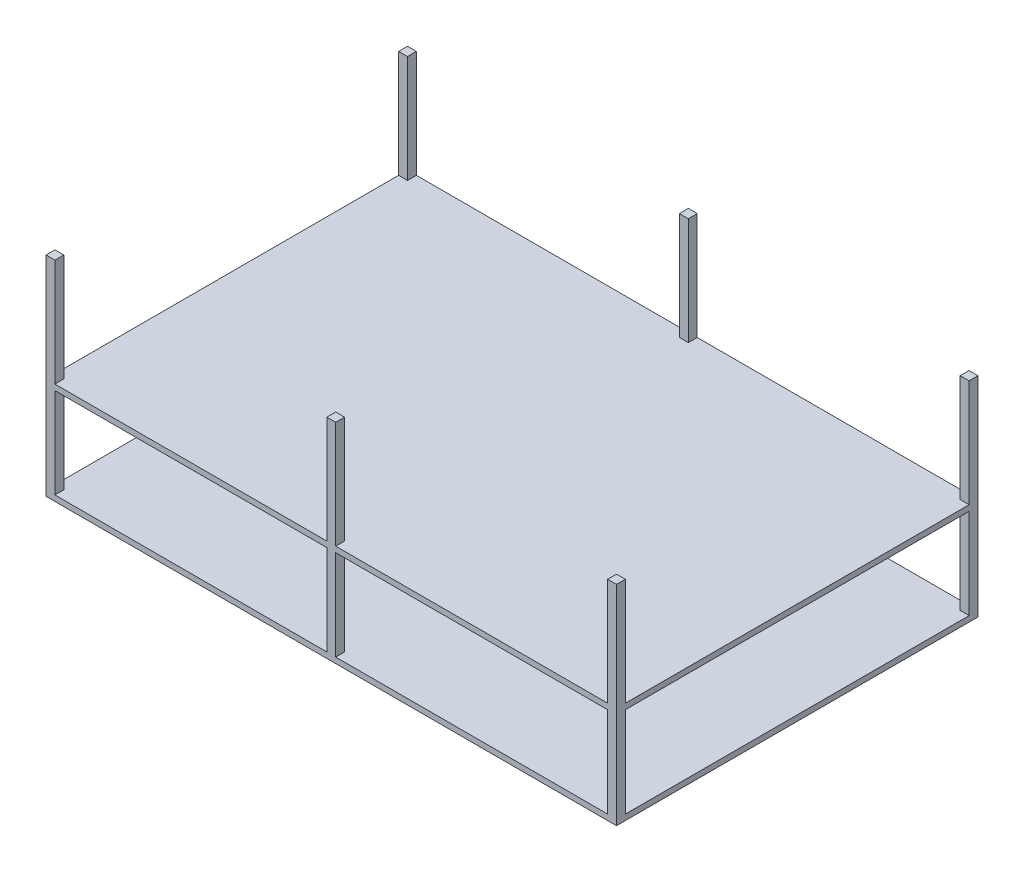
from build123d import *

# Parameters (mm, degrees)
SKETCH1_W             = 40
SKETCH1_H             = 40
BOSS_EXTRUDE1_DEPTH   = 939.8
BOSS_EXTRUDE1_2_DEPTH = 939.8
BOSS_EXTRUDE1_3_DEPTH = 939.8
BOSS_EXTRUDE1_4_DEPTH = 939.8
BOSS_EXTRUDE1_5_DEPTH = 939.8
BOSS_EXTRUDE1_6_DEPTH = 939.8
SKETCH2_W             = 2565.4
SKETCH2_H             = 1625.6
BOSS_EXTRUDE2_DEPTH   = 25.4
SKETCH3_W             = 2565.4
SKETCH3_H             = 1625.6
BOSS_EXTRUDE3_DEPTH   = 25.4


with BuildPart() as part:
    # Sketch1 → Boss-Extrude1 (new body)
    with BuildSketch(Plane.XZ.offset(-2661.458218508)):
        with Locations((1253.466421536, 801.437438082)):
            Rectangle(SKETCH1_W, SKETCH1_H)
    extrude(amount=BOSS_EXTRUDE1_DEPTH)



with BuildPart() as body_2:
    # Sketch1 → Boss-Extrude1 2 (new body)
    with BuildSketch(Plane.XZ.offset(-2661.458218508)):
        with Locations((-1271.933578464, 801.437438082)):
            Rectangle(SKETCH1_W, SKETCH1_H)
    extrude(amount=BOSS_EXTRUDE1_2_DEPTH)


with BuildPart() as body_3:
    # Sketch1 → Boss-Extrude1 3 (new body)
    with BuildSketch(Plane.XZ.offset(-2661.458218508)):
        with Locations((-9.233578464, 801.437438082)):
            Rectangle(SKETCH1_W, SKETCH1_H)
    extrude(amount=BOSS_EXTRUDE1_3_DEPTH)


with BuildPart() as body_4:
    # Sketch1 → Boss-Extrude1 4 (new body)
    with BuildSketch(Plane.XZ.offset(-2661.458218508)):
        with Locations((-1271.933578464, -784.162561918)):
            Rectangle(SKETCH1_W, SKETCH1_H)
    extrude(amount=BOSS_EXTRUDE1_4_DEPTH)


with BuildPart() as body_5:
    # Sketch1 → Boss-Extrude1 5 (new body)
    with BuildSketch(Plane.XZ.offset(-2661.458218508)):
        with Locations((-9.233578464, -784.162561918)):
            Rectangle(SKETCH1_W, SKETCH1_H)
    extrude(amount=BOSS_EXTRUDE1_5_DEPTH)


with BuildPart() as body_6:
    # Sketch1 → Boss-Extrude1 6 (new body)
    with BuildSketch(Plane.XZ.offset(-2661.458218508)):
        with Locations((1253.466421536, -784.162561918)):
            Rectangle(SKETCH1_W, SKETCH1_H)
    extrude(amount=BOSS_EXTRUDE1_6_DEPTH)


with BuildPart() as part_1:
    add(part.part)

    add(body_2.part)  # Boss-Extrude2 merges body 2

    add(body_3.part)  # Boss-Extrude2 merges body 3

    add(body_4.part)  # Boss-Extrude2 merges body 4

    add(body_5.part)  # Boss-Extrude2 merges body 5

    add(body_6.part)  # Boss-Extrude2 merges body 6
    # Sketch2 → Boss-Extrude2 (add)
    with BuildSketch(Plane.XZ.offset(-1721.658218508)):
        with Locations((-9.233578464, 8.637438082)):
            Rectangle(SKETCH2_W, SKETCH2_H)
    extrude(amount=-BOSS_EXTRUDE2_DEPTH)

    # Sketch3 → Boss-Extrude3 (add)
    with BuildSketch(Plane.XZ.offset(-2153.458218508)):
        with Locations((-9.233578464, 8.637438082)):
            Rectangle(SKETCH3_W, SKETCH3_H)
    extrude(amount=-BOSS_EXTRUDE3_DEPTH)


solid = part_1.part
